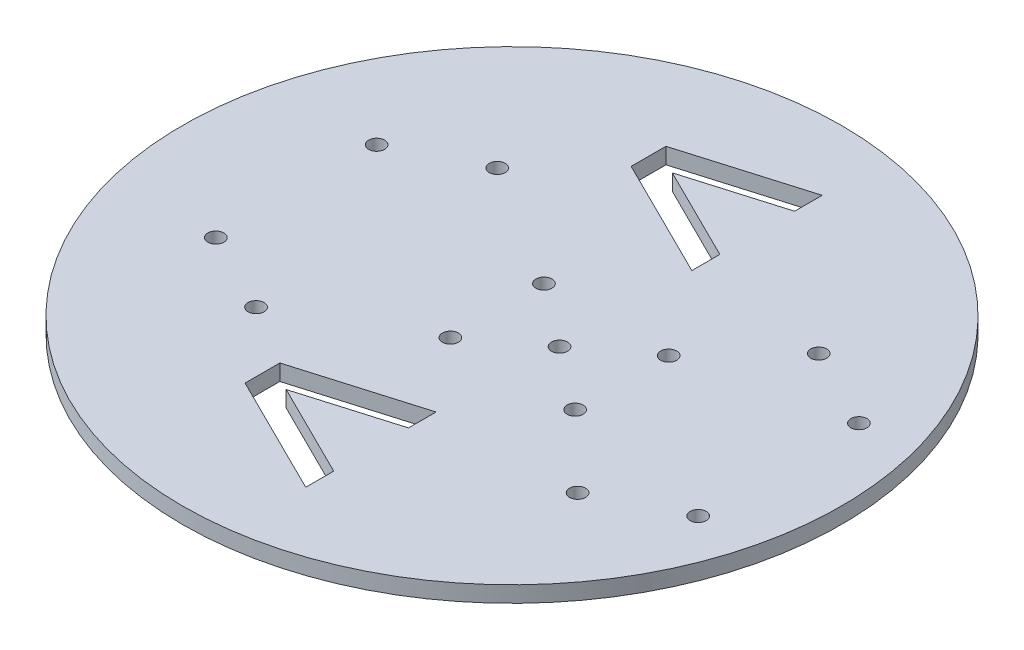
from build123d import *

# Parameters (mm, degrees)
EXTRUDE_2426_DEPTH          = 2
CUT_EXTRUDE_2700_DEPTH      = 184.109257002
CUT_EXTRUDE_2700_DEPTH_BACK = 184.109257002
SKETCH_5_R                  = 92
SKETCH_5_R_2                = 82
VV_DEPTH                    = 121.533854246
VV_DEPTH_BACK               = 121.533854246
CUT_EXTRUDE_7_DEPTH         = 121.533854246
CUT_EXTRUDE_7_DEPTH_BACK    = 121.533854246
SKETCH_10_R                 = 2
CUT_EXTRUDE_8_DEPTH         = 121.533854246
CUT_EXTRUDE_8_DEPTH_BACK    = 121.533854246
SKETCH_17_R                 = 2
CUT_EXTRUDE_9_DEPTH         = 121.533854246
CUT_EXTRUDE_9_DEPTH_BACK    = 121.533854246
SKETCH_6_R                  = 2


with BuildPart() as part:
    # 草图1 → Extrude 2426 (new, symmetric)
    with BuildSketch(Plane(origin=(0, 0, 0), x_dir=(1, 0, 0), z_dir=(0, 1, 0))):
        Polygon((-150, -85), (-150, 85), (-110, 85), (-69, 85), (-62, 85), (-25, 105), (-2, 105), (30, 105), (56.423376881, 85), (67.423376881, 85), (108.643784617, 85), (108.643784617, 70), (123.423376881, 70), (138, 40), (150, 40), (150, -40), (138, -40), (123.423376881, -70), (108.643784617, -70), (108.643784617, -85), (67.423376881, -85), (56.423376881, -85), (30, -105), (-2, -105), (-25, -105), (-62, -85), (-69, -85), (-110, -85), align=None)
    extrude(amount=EXTRUDE_2426_DEPTH, both=True)

    # 草图5 → Cut-Extrude 2700 (cut, two sides: drawn at the far end of the back side and taken through both)
    with BuildSketch(Plane(origin=(0, 0, 0), x_dir=(1, 0, 0), z_dir=(0, 1, 0)).offset(-CUT_EXTRUDE_2700_DEPTH_BACK)):
        with Locations((-6.31992991, 0)):
            Circle(SKETCH_5_R)
        with Locations(Location((-6.31992991, 0, 0), (0, 0, 270))):
            Circle(SKETCH_5_R_2, mode=Mode.SUBTRACT)
    extrude(amount=CUT_EXTRUDE_2700_DEPTH + CUT_EXTRUDE_2700_DEPTH_BACK, mode=Mode.SUBTRACT)


with BuildPart() as body_2:
    # of the pieces the cut leaves, the one that is kept (cut_extrude_2700_keep)
    add(part.part.solids().sort_by_distance((-6.31992991, -2, 82))[0])

    # 草图11 → vv (cut, two sides: drawn at the far end of the back side and taken through both)
    with BuildSketch(Plane(origin=(0, 0, 0), x_dir=(1, 0, 0), z_dir=(0, 1, 0)).offset(-VV_DEPTH_BACK)):
        Polygon((6.325153319, 64.535132696), (-23.677770795, 55.665092595), (-23.677770795, 47.002272942), (6.325153319, 32.096278657), (6.325153319, 39.061910109), (-17.161984245, 50.730744019), (6.325153319, 57.674462279), align=None)
        Polygon((4.981591187, -30.190121431), (-25.021332927, -39.060161532), (-25.021332927, -47.722981185), (4.981591187, -62.62897547), (4.981591187, -55.663344018), (-18.505546377, -43.994510108), (4.981591187, -37.050791848), align=None)
    extrude(amount=VV_DEPTH + VV_DEPTH_BACK, mode=Mode.SUBTRACT)

    # 草图10 → 切除-拉伸7 (cut, two sides: drawn at the far end of the back side and taken through both)
    with BuildSketch(Plane(origin=(0, 0, 0), x_dir=(1, 0, 0), z_dir=(0, 1, 0)).offset(-CUT_EXTRUDE_7_DEPTH_BACK)):
        with Locations((-130, 65)):
            Circle(SKETCH_10_R)
        with Locations((-130, -65)):
            Circle(SKETCH_10_R)
        with Locations((115, 55)):
            Circle(SKETCH_10_R)
        with Locations((115, -55)):
            Circle(SKETCH_10_R)
        with Locations(Location((-60, 20, 0), (0, 0, 270))):
            Circle(SKETCH_10_R)
        with Locations(Location((-60, -20, 0), (0, 0, 270))):
            Circle(SKETCH_10_R)
        with Locations(Location((60, 20, 0), (0, 0, 270))):
            Circle(SKETCH_10_R)
        with Locations(Location((60, -20, 0), (0, 0, 270))):
            Circle(SKETCH_10_R)
    extrude(amount=CUT_EXTRUDE_7_DEPTH + CUT_EXTRUDE_7_DEPTH_BACK, mode=Mode.SUBTRACT)

    # 草图17 → 切除-拉伸8 (cut, two sides: drawn at the far end of the back side and taken through both)
    with BuildSketch(Plane(origin=(0, 0, 0), x_dir=(1, 0, 0), z_dir=(0, 1, 0)).offset(-CUT_EXTRUDE_8_DEPTH_BACK)):
        with Locations(Location((-40, 30, 0), (0, 0, 270))):
            Circle(SKETCH_17_R)
        with Locations(Location((40, 30, 0), (0, 0, 270))):
            Circle(SKETCH_17_R)
        with Locations(Location((-40, -30, 0), (0, 0, 270))):
            Circle(SKETCH_17_R)
        with Locations(Location((40, -30, 0), (0, 0, 270))):
            Circle(SKETCH_17_R)
    extrude(amount=CUT_EXTRUDE_8_DEPTH + CUT_EXTRUDE_8_DEPTH_BACK, mode=Mode.SUBTRACT)

    # 草图6 → 切除-拉伸9 (cut, two sides: drawn at the far end of the back side and taken through both)
    with BuildSketch(Plane(origin=(0, 0, 0), x_dir=(1, 0, 0), z_dir=(0, 1, 0)).offset(-CUT_EXTRUDE_9_DEPTH_BACK)):
        with Locations(Location((21.774981178, -12.387805022, 0), (0, 0, 270))):
            Circle(SKETCH_6_R)
        with Locations(Location((-9.265018822, 10.892194978, 0), (0, 0, 270))):
            Circle(SKETCH_6_R)
        with Locations(Location((-9.265018822, -12.387805022, 0), (0, 0, 270))):
            Circle(SKETCH_6_R)
        with Locations(Location((6.254981178, -0.747805022, 0), (0, 0, 270))):
            Circle(SKETCH_6_R)
        with Locations(Location((21.774981178, 10.892194978, 0), (0, 0, 270))):
            Circle(SKETCH_6_R)
    extrude(amount=CUT_EXTRUDE_9_DEPTH + CUT_EXTRUDE_9_DEPTH_BACK, mode=Mode.SUBTRACT)


solid = body_2.part
